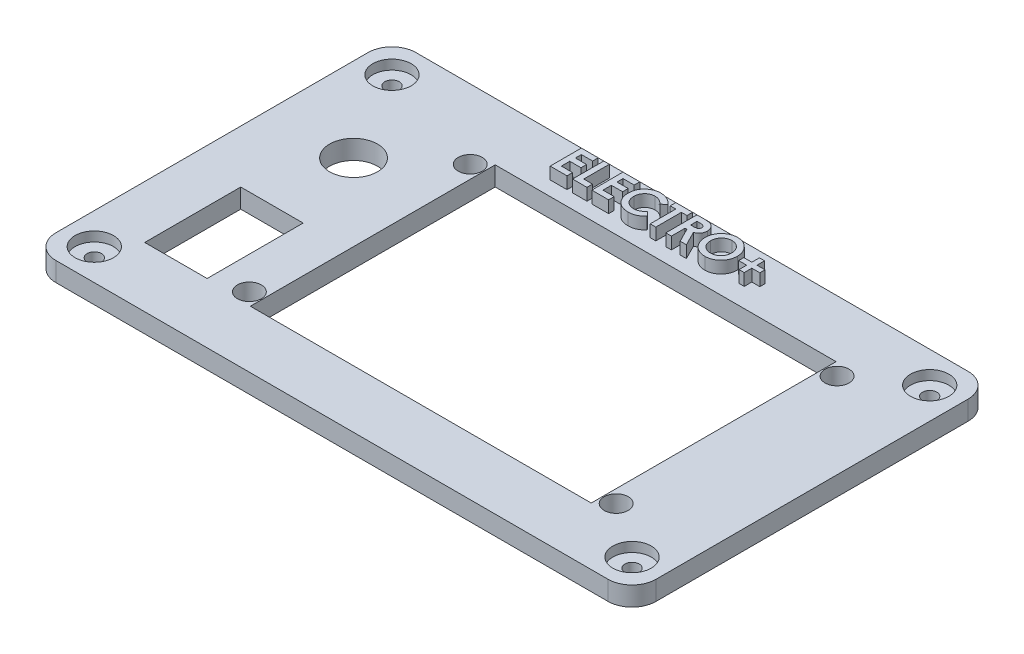
from build123d import *

# Parameters (mm, degrees)
CROQUIS1_W              = 114
CROQUIS1_H              = 64
SALIENTE_EXTRUIR1_DEPTH = 5
CROQUIS2_W              = 125
CROQUIS2_H              = 75
SALIENTE_EXTRUIR2_DEPTH = 4
CROQUIS4_R              = 2.5
CROQUIS4_W              = 71
CROQUIS4_H              = 51
CORTAR_EXTRUIR1_DEPTH   = 74.440452068
CROQUIS5_R              = 5
CROQUIS5_W              = 13
CROQUIS5_H              = 20
CORTAR_EXTRUIR2_DEPTH   = 74.440452068
CROQUIS12_W             = 84
CROQUIS12_H             = 4
CROQUIS12_W_2           = 4
CROQUIS12_H_2           = 34
CROQUIS12_W_3           = 106
CROQUIS12_H_3           = 56
CROQUIS12_R             = 5
CROQUIS12_R_2           = 2.5
CROQUIS12_W_4           = 71
CROQUIS12_H_4           = 51
CROQUIS12_W_5           = 13
CROQUIS12_H_5           = 20
CORTAR_EXTRUIR3_DEPTH   = 5
CROQUIS13_R             = 1.5
CORTAR_EXTRUIR4_DEPTH   = 10
REDONDEO1_R             = 5
CROQUIS15_R             = 4
CORTAR_EXTRUIR5_DEPTH   = 2
SALIENTE_EXTRUIR3_DEPTH = 2.5


with BuildPart() as part:
    # Croquis1 → Saliente-Extruir1 (new body)
    with BuildSketch(Plane(origin=(0, 0, 0), x_dir=(1, 0, 0), z_dir=(0, 1, 0))):
        Rectangle(CROQUIS1_W, CROQUIS1_H)
    extrude(amount=SALIENTE_EXTRUIR1_DEPTH)

    # Croquis2 → Saliente-Extruir2 (add)
    with BuildSketch(Plane(origin=(0, 5, 0), x_dir=(1, 0, 0), z_dir=(0, 1, 0))):
        Rectangle(CROQUIS2_W, CROQUIS2_H)
    extrude(amount=SALIENTE_EXTRUIR2_DEPTH)

    # Croquis4 → Cortar-Extruir1 (cut, through all)
    with BuildSketch(Plane.XZ):
        with Locations(Location((44.7, 23, 0), (0, 0, 270))):
            Circle(CROQUIS4_R)
        with Locations(Location((-31.7, 23, 0), (0, 0, 90))):
            Circle(CROQUIS4_R)
        with Locations(Location((44.7, -23, 0), (0, 0, 90))):
            Circle(CROQUIS4_R)
        with Locations(Location((-31.7, -23, 0), (0, 0, 270))):
            Circle(CROQUIS4_R)
        with Locations((6.5, 0)):
            Rectangle(CROQUIS4_W, CROQUIS4_H)
    extrude(amount=-CORTAR_EXTRUIR1_DEPTH, mode=Mode.SUBTRACT)

    # Croquis5 → Cortar-Extruir2 (cut, through all)
    with BuildSketch(Plane.XZ):
        with Locations(Location((-45, -12, 0), (0, 0, 270))):
            Circle(CROQUIS5_R)
        with Locations((-45, 15)):
            Rectangle(CROQUIS5_W, CROQUIS5_H)
    extrude(amount=-CORTAR_EXTRUIR2_DEPTH, mode=Mode.SUBTRACT)

    # Croquis12 → Cortar-Extruir3 (cut)
    # profile 1 of 9: a face of its own
    with BuildSketch(Plane.XZ):
        with Locations((0, 30)):
            Rectangle(CROQUIS12_W, CROQUIS12_H)
    # profile 2 of 9: a face of its own
    with BuildSketch(Plane.XZ):
        with Locations((-55, 0)):
            Rectangle(CROQUIS12_W_2, CROQUIS12_H_2)
    # profile 3 of 9: a face of its own
    with BuildSketch(Plane.XZ):
        with Locations((0, -30)):
            Rectangle(CROQUIS12_W, CROQUIS12_H)
    # profile 4 of 9: a face of its own
    with BuildSketch(Plane.XZ):
        with Locations((55, 0)):
            Rectangle(CROQUIS12_W_2, CROQUIS12_H_2)
    # profile 5 of 9: a face of its own
    with BuildSketch(Plane.XZ):
        Rectangle(CROQUIS12_W_3, CROQUIS12_H_3)
        with Locations(Location((-45, -12, 0), (0, 0, 270))):
            Circle(CROQUIS12_R, mode=Mode.SUBTRACT)
        with Locations(Location((-31.7, 23, 0), (0, 0, 270))):
            Circle(CROQUIS12_R_2, mode=Mode.SUBTRACT)
        with Locations(Location((-31.7, -23, 0), (0, 0, 270))):
            Circle(CROQUIS12_R_2, mode=Mode.SUBTRACT)
        with Locations(Location((44.7, -23, 0), (0, 0, 270))):
            Circle(CROQUIS12_R_2, mode=Mode.SUBTRACT)
        with Locations(Location((44.7, 23, 0), (0, 0, 270))):
            Circle(CROQUIS12_R_2, mode=Mode.SUBTRACT)
        with Locations((6.5, 0)):
            Rectangle(CROQUIS12_W_4, CROQUIS12_H_4, mode=Mode.SUBTRACT)
        with Locations((-45, 15)):
            Rectangle(CROQUIS12_W_5, CROQUIS12_H_5, mode=Mode.SUBTRACT)
    # profile 6 of 9: a face of its own
    with BuildSketch(Plane.XZ):
        Polygon((53, 28), (53, 17), (57, 17), (57, 32), (42, 32), (42, 28), align=None)
    # profile 7 of 9: a face of its own
    with BuildSketch(Plane.XZ):
        Polygon((53, -28), (42, -28), (42, -32), (57, -32), (57, -17), (53, -17), align=None)
    # profile 8 of 9: a face of its own
    with BuildSketch(Plane.XZ):
        Polygon((-42, -28), (-53, -28), (-53, -17), (-57, -17), (-57, -32), (-42, -32), align=None)
    # profile 9 of 9: a face of its own
    with BuildSketch(Plane.XZ):
        Polygon((-57, 17), (-53, 17), (-53, 28), (-42, 28), (-42, 32), (-57, 32), align=None)
    extrude(amount=-CORTAR_EXTRUIR3_DEPTH, mode=Mode.SUBTRACT)

    # Croquis13 → Cortar-Extruir4 (cut)
    with BuildSketch(Plane(origin=(0, 9, 0), x_dir=(1, 0, 0), z_dir=(0, 1, 0))):
        with Locations(Location((56, 31, 0), (0, 0, 270))):
            Circle(CROQUIS13_R)
        with Locations(Location((56, -31, 0), (0, 0, 90))):
            Circle(CROQUIS13_R)
        with Locations(Location((-56, -31, 0), (0, 0, 270))):
            Circle(CROQUIS13_R)
        with Locations(Location((-56, 31, 0), (0, 0, 90))):
            Circle(CROQUIS13_R)
    extrude(amount=-CORTAR_EXTRUIR4_DEPTH, mode=Mode.SUBTRACT)

    # Redondeo1
    redondeo1_edges = [part.edges().sort_by_distance(p)[0] for p in [
        (62.5, 7, 37.5),
        (62.5, 7, -37.5),
        (-62.5, 7, -37.5),
        (-62.5, 7, 37.5),
    ]]
    fillet(redondeo1_edges, radius=REDONDEO1_R)

    # Croquis15 → Cortar-Extruir5 (cut)
    with BuildSketch(Plane(origin=(0, 9, 0), x_dir=(1, 0, 0), z_dir=(0, 1, 0))):
        with Locations(Location((-56, 31, 0), (0, 0, 270))):
            Circle(CROQUIS15_R)
        with Locations(Location((56, 31, 0), (0, 0, 90))):
            Circle(CROQUIS15_R)
        with Locations(Location((56, -31, 0), (0, 0, 270))):
            Circle(CROQUIS15_R)
        with Locations(Location((-56, -31, 0), (0, 0, 90))):
            Circle(CROQUIS15_R)
    extrude(amount=-CORTAR_EXTRUIR5_DEPTH, mode=Mode.SUBTRACT)

    # Croquis16 → Saliente-Extruir3 (add)
    # profile 1 of 8: a face of its own
    with BuildSketch(Plane(origin=(0, 9, 0), x_dir=(1, 0, 0), z_dir=(0, 1, 0))):
        Polygon((-20.55, 35), (-17.05, 35), (-17.05, 33.833333333), (-19.383333333, 33.833333333), (-19.383333333, 32.583333333), (-17.05, 32.583333333), (-17.05, 31.416666667), (-19.383333333, 31.416666667), (-19.383333333, 29.666666667), (-17.05, 29.666666667), (-17.05, 28.5), (-20.55, 28.5), align=None)
    # profile 2 of 8: a face of its own
    with BuildSketch(Plane(origin=(0, 9, 0), x_dir=(1, 0, 0), z_dir=(0, 1, 0))):
        Polygon((-15.883333333, 35), (-14.716666667, 35), (-14.716666667, 29.666666667), (-12.883333333, 29.666666667), (-12.883333333, 28.5), (-15.883333333, 28.5), align=None)
    # profile 3 of 8: a face of its own
    with BuildSketch(Plane(origin=(0, 9, 0), x_dir=(1, 0, 0), z_dir=(0, 1, 0))):
        Polygon((-11.883333333, 35), (-8.383333333, 35), (-8.383333333, 33.833333333), (-10.716666667, 33.833333333), (-10.716666667, 32.583333333), (-8.383333333, 32.583333333), (-8.383333333, 31.416666667), (-10.716666667, 31.416666667), (-10.716666667, 29.666666667), (-8.383333333, 29.666666667), (-8.383333333, 28.5), (-11.883333333, 28.5), align=None)
    # profile 4 of 8: a face of its own
    with BuildSketch(Plane(origin=(0, 9, 0), x_dir=(1, 0, 0), z_dir=(0, 1, 0))):
        with BuildLine():
            Line((-1.383333333, 33.872395833), (-2.238802083, 33.0546875))
            add(Edge.make_bspline(
                [(-2.238802083, 33.0546875), (-2.311369912, 33.129722757), (-2.453117616, 33.27629012), (-2.681526511, 33.470332393), (-2.919063445, 33.632040373), (-3.161107612, 33.768229804), (-3.412012684, 33.871266815), (-3.668877516, 33.94635162), (-3.933342264, 33.992127988), (-4.112321834, 33.997365614), (-4.20234375, 34)],
                knots=[0, 0, 0, 0, 1.115251505, 2.178435587, 3.19620269, 4.182487026, 5.141301733, 6.088180966, 7.038406374, 8, 8, 8, 8], degree=3))
            add(Edge.make_bspline(
                [(-4.20234375, 34), (-4.27752299, 33.997918743), (-4.425880937, 33.993811613), (-4.643709281, 33.963702294), (-4.852073349, 33.912500087), (-5.051686405, 33.841933961), (-5.241961079, 33.750625139), (-5.423296305, 33.638644292), (-5.595245009, 33.507002767), (-5.755535848, 33.356381682), (-5.902164275, 33.191816828), (-6.031719826, 33.016226522), (-6.140243382, 32.83001303), (-6.2293069, 32.635062187), (-6.298683937, 32.430471663), (-6.348227858, 32.216379196), (-6.376882737, 31.99252982), (-6.38115967, 31.840358682), (-6.383333333, 31.763020833)],
                knots=[0, 0, 0, 0, 1.035432265, 2.043311493, 3.022114605, 3.98653278, 4.95457646, 5.923598177, 6.917315552, 7.932509744, 8.948865224, 9.949768934, 10.933144597, 11.912367597, 12.897413939, 13.903909035, 14.934704909, 16, 16, 16, 16], degree=3))
            add(Edge.make_bspline(
                [(-6.383333333, 31.763020833), (-6.382706908, 31.70873972), (-6.381472212, 31.60175053), (-6.367956277, 31.443483824), (-6.346192434, 31.289927704), (-6.314694761, 31.141314765), (-6.275306612, 30.997516219), (-6.229095344, 30.857291522), (-6.171123988, 30.722578265), (-6.106774908, 30.59181184), (-6.03193767, 30.468560373), (-5.951249322, 30.35102987), (-5.863755982, 30.239796454), (-5.76889095, 30.135314851), (-5.66531912, 30.039217873), (-5.555717441, 29.948615772), (-5.438237082, 29.865776624), (-5.31531841, 29.788621489), (-5.185899562, 29.721596167), (-5.053491972, 29.660884175), (-4.916088073, 29.61157701), (-4.775360841, 29.571830937), (-4.631813185, 29.538032838), (-4.484041076, 29.51722231), (-4.333325513, 29.50146274), (-4.23146709, 29.500489679), (-4.180208333, 29.5)],
                knots=[0, 0, 0, 0, 1.103660481, 2.175337485, 3.227646561, 4.255952547, 5.262355991, 6.258840057, 7.255597736, 8.242457506, 9.22035537, 10.185017736, 11.140346927, 12.096287581, 13.051739095, 14.01125915, 14.986044842, 15.97314143, 16.960198552, 17.947847494, 18.933482797, 19.925264591, 20.920966487, 21.929612487, 22.958107872, 24, 24, 24, 24], degree=3))
            add(Edge.make_bspline(
                [(-4.180208333, 29.5), (-4.093264673, 29.502514872), (-3.92244299, 29.507455942), (-3.671737608, 29.546094406), (-3.432840355, 29.609652494), (-3.241962594, 29.684710902), (-3.092414909, 29.758832054), (-2.978566468, 29.82739047), (-2.860838306, 29.904080586), (-2.741185788, 29.991796769), (-2.61826306, 30.089486391), (-2.494239992, 30.199289036), (-2.365941572, 30.31758906), (-2.281894548, 30.402022111), (-2.238802083, 30.4453125)],
                knots=[0, 0, 0, 0, 1.404581149, 2.759636711, 4.088442092, 5.392261763, 6.066678138, 6.783632037, 7.538459478, 8.336747902, 9.180226004, 10.074962426, 11.012997595, 12, 12, 12, 12], degree=3))
            Line((-2.238802083, 30.4453125), (-1.409375, 29.57421875))
            add(Edge.make_bspline(
                [(-1.409375, 29.57421875), (-1.46767926, 29.517927818), (-1.581476705, 29.408059957), (-1.753136993, 29.252057846), (-1.92458124, 29.111872607), (-2.091667709, 28.982416131), (-2.257133452, 28.867459799), (-2.420960921, 28.766888802), (-2.581295518, 28.678159555), (-2.741466642, 28.602768433), (-2.90247096, 28.538753541), (-3.068125482, 28.48364092), (-3.238936631, 28.437017626), (-3.415947642, 28.39939875), (-3.597507465, 28.369233491), (-3.785315259, 28.348872115), (-3.978180229, 28.335183839), (-4.109003526, 28.333953834), (-4.175, 28.333333333)],
                knots=[0, 0, 0, 0, 1.244526981, 2.429050516, 3.560637417, 4.644440555, 5.67424972, 6.652764056, 7.595344123, 8.486817594, 9.369275933, 10.254498637, 11.166417451, 12.086725134, 13.032340136, 13.991389299, 14.986715468, 16, 16, 16, 16], degree=3))
            add(Edge.make_bspline(
                [(-4.175, 28.333333333), (-4.296227347, 28.33642366), (-4.533435569, 28.342470571), (-4.881058033, 28.387274084), (-5.211290042, 28.462386386), (-5.524934989, 28.568615897), (-5.821893143, 28.70431912), (-6.102088532, 28.870684899), (-6.365069544, 29.067271226), (-6.608711809, 29.29177392), (-6.829097834, 29.539718298), (-7.023893557, 29.805942538), (-7.185028587, 30.091755037), (-7.318822475, 30.392933429), (-7.423447535, 30.710852108), (-7.497085841, 31.045854967), (-7.542498046, 31.397618539), (-7.547466206, 31.637881168), (-7.55, 31.760416667)],
                knots=[0, 0, 0, 0, 1.078019885, 2.10938526, 3.111377082, 4.085535484, 5.04941344, 6.010039228, 6.978205633, 7.964457913, 8.951525778, 9.924444315, 10.892603023, 11.863865945, 12.85144698, 13.863884204, 14.910567087, 16, 16, 16, 16], degree=3))
            add(Edge.make_bspline(
                [(-7.55, 31.760416667), (-7.548929342, 31.840333274), (-7.546807558, 31.998708457), (-7.524507419, 32.232007932), (-7.493419728, 32.45943319), (-7.444101933, 32.678622802), (-7.384654195, 32.892529657), (-7.310723123, 33.098828837), (-7.222426794, 33.298113267), (-7.122611207, 33.49071656), (-7.009690832, 33.67537696), (-6.883546377, 33.850507941), (-6.747425292, 34.017461483), (-6.59805681, 34.174022638), (-6.437611448, 34.321566042), (-6.265364817, 34.459292129), (-6.082352892, 34.589176048), (-5.888080329, 34.707868407), (-5.686321326, 34.815231955), (-5.479620594, 34.909931189), (-5.268485974, 34.989077941), (-5.053810162, 35.054727253), (-4.834686156, 35.103729822), (-4.612678006, 35.140823185), (-4.38589669, 35.161558613), (-4.233632683, 35.164953135), (-4.156770833, 35.166666667)],
                knots=[0, 0, 0, 0, 1.071919942, 2.124283339, 3.142214191, 4.149696895, 5.136002878, 6.119640489, 7.086990633, 8.058538607, 9.028339693, 9.988281803, 10.952401235, 11.916291999, 12.888973767, 13.874849856, 14.873389453, 15.898127285, 16.927174885, 17.938320013, 18.946391617, 19.950418109, 20.947802303, 21.956882652, 22.968648068, 24, 24, 24, 24], degree=3))
            add(Edge.make_bspline(
                [(-4.156770833, 35.166666667), (-4.091199795, 35.165684427), (-3.960739474, 35.163730162), (-3.766462165, 35.147439229), (-3.573738594, 35.121854485), (-3.383258772, 35.083252554), (-3.193660192, 35.037427184), (-3.007434392, 34.977425183), (-2.821643559, 34.910541645), (-2.639201547, 34.830596033), (-2.459853692, 34.743328176), (-2.287801502, 34.644319623), (-2.120156236, 34.539663249), (-1.960632812, 34.423165033), (-1.806243013, 34.29905058), (-1.657794156, 34.166740828), (-1.516588968, 34.024029785), (-1.427976432, 33.923196008), (-1.383333333, 33.872395833)],
                knots=[0, 0, 0, 0, 0.996412454, 1.982464992, 2.961075852, 3.949442424, 4.934965278, 5.923860011, 6.921385422, 7.934793307, 8.949617135, 9.951082467, 10.950285876, 11.951772932, 12.951063433, 13.960125323, 14.972308753, 16, 16, 16, 16], degree=3))
        make_face()
    # profile 5 of 8: a face of its own
    with BuildSketch(Plane(origin=(0, 9, 0), x_dir=(1, 0, 0), z_dir=(0, 1, 0))):
        Polygon((-0.883333333, 35), (2.616666667, 35), (2.616666667, 33.833333333), (1.45, 33.833333333), (1.45, 28.5), (0.283333333, 28.5), (0.283333333, 33.833333333), (-0.883333333, 33.833333333), align=None)
    # profile 6 of 8: a face of its own
    with BuildSketch(Plane(origin=(0, 9, 0), x_dir=(1, 0, 0), z_dir=(0, 1, 0))):
        with BuildLine():
            Line((3.533333333, 35), (4.892708333, 35))
            add(Edge.make_bspline(
                [(4.892708333, 35), (4.982562607, 34.999681069), (5.155377686, 34.999067675), (5.404567591, 34.989389937), (5.633482788, 34.97592257), (5.842462206, 34.955371011), (6.031416441, 34.928122127), (6.20053487, 34.896000203), (6.349812548, 34.859390384), (6.480508427, 34.81377166), (6.598454995, 34.762314432), (6.708397594, 34.703189133), (6.812761722, 34.637054142), (6.910849816, 34.562169269), (7.003514286, 34.479881674), (7.090929948, 34.390108527), (7.171861539, 34.292088588), (7.245807926, 34.186441219), (7.313204105, 34.075302609), (7.372768193, 33.958520165), (7.421205807, 33.836012671), (7.464005632, 33.709550627), (7.49483296, 33.577326232), (7.516272915, 33.440626714), (7.531970412, 33.298970874), (7.532872943, 33.202736187), (7.533333333, 33.153645833)],
                knots=[0, 0, 0, 0, 1.749336639, 3.364467119, 4.854658419, 6.213483162, 7.451590619, 8.570285859, 9.5643256, 10.440900261, 11.26203566, 12.067320669, 12.869050712, 13.665104639, 14.467235401, 15.27997916, 16.102287765, 16.939272006, 17.78853747, 18.631303466, 19.488103222, 20.351255419, 21.228522269, 22.127379805, 23.044756219, 24, 24, 24, 24], degree=3))
            add(Edge.make_bspline(
                [(7.533333333, 33.153645833), (7.532137404, 33.102406782), (7.529792403, 33.00193634), (7.517160956, 32.854353456), (7.494074638, 32.713156475), (7.459107052, 32.578758805), (7.418916352, 32.449487711), (7.365473032, 32.327728324), (7.305156963, 32.211709831), (7.23352133, 32.103073358), (7.154904722, 31.999405871), (7.063475261, 31.904679257), (6.965156172, 31.813802318), (6.854420579, 31.732467278), (6.736149812, 31.655174554), (6.607993954, 31.585126763), (6.470789395, 31.520563064), (6.374327795, 31.484557886), (6.325, 31.466145833)],
                knots=[0, 0, 0, 0, 1.099860209, 2.156625411, 3.176576793, 4.16617041, 5.135385252, 6.078461593, 7.016046972, 7.938469504, 8.868247731, 9.803980173, 10.76021508, 11.73834243, 12.748633912, 13.790971185, 14.870363756, 16, 16, 16, 16], degree=3))
            Line((6.325, 31.466145833), (7.825, 28.5))
            Line((7.825, 28.5), (6.528125, 28.5))
            Line((6.528125, 28.5), (5.095833333, 31.333333333))
            Line((5.095833333, 31.333333333), (4.7, 31.333333333))
            Line((4.7, 31.333333333), (4.7, 28.5))
            Line((4.7, 28.5), (3.533333333, 28.5))
            Line((3.533333333, 28.5), (3.533333333, 35))
        make_face()
        with BuildLine():
            Line((4.7, 32.5), (5.154427083, 32.5))
            add(Edge.make_bspline(
                [(5.154427083, 32.5), (5.209984572, 32.500625726), (5.316365224, 32.501823856), (5.469354574, 32.507381282), (5.608305391, 32.520771931), (5.733814374, 32.537690516), (5.846513075, 32.557225465), (5.945396261, 32.585220234), (6.03198757, 32.615217337), (6.105260892, 32.652495955), (6.167863935, 32.694889829), (6.221917656, 32.743050324), (6.266627833, 32.798789965), (6.30342659, 32.860593988), (6.332052022, 32.929009035), (6.352946394, 33.003284063), (6.364623258, 33.084265162), (6.365966721, 33.140153146), (6.366666667, 33.169270833)],
                knots=[0, 0, 0, 0, 1.688639943, 3.233382647, 4.650958383, 5.928841754, 7.082724185, 8.122798841, 9.049171256, 9.863274652, 10.613301712, 11.341792392, 12.054588806, 12.776240173, 13.521029143, 14.301969904, 15.115324896, 16, 16, 16, 16], degree=3))
            add(Edge.make_bspline(
                [(6.366666667, 33.169270833), (6.365343356, 33.203719183), (6.362743957, 33.271386581), (6.336949845, 33.368803908), (6.295891189, 33.458970309), (6.239611019, 33.54147839), (6.168733461, 33.613810669), (6.087395871, 33.67757215), (5.993842787, 33.727989958), (5.907219672, 33.761245007), (5.828412885, 33.781141846), (5.757292245, 33.795968795), (5.674934117, 33.806477079), (5.581276323, 33.817622984), (5.476557602, 33.82485054), (5.360207172, 33.830125215), (5.232559192, 33.832283344), (5.143576427, 33.832973259), (5.097135417, 33.833333333)],
                knots=[0, 0, 0, 0, 1.020303359, 2.004196876, 2.966617323, 3.9489082, 4.950758222, 5.960522915, 7.003732012, 8.091992268, 8.70421221, 9.413913587, 10.24622431, 11.166358409, 12.212345909, 13.359657661, 14.621978493, 16, 16, 16, 16], degree=3))
            Line((5.097135417, 33.833333333), (4.7, 33.833333333))
            Line((4.7, 33.833333333), (4.7, 32.5))
        make_face(mode=Mode.SUBTRACT)
    # profile 7 of 8: a face of its own
    with BuildSketch(Plane(origin=(0, 9, 0), x_dir=(1, 0, 0), z_dir=(0, 1, 0))):
        with BuildLine():
            add(Edge.make_bspline(
                [(11.838020833, 35.166666667), (11.951031299, 35.163740623), (12.174139556, 35.157963951), (12.50225129, 35.109810879), (12.818447613, 35.031352351), (13.122585543, 34.922289323), (13.413903553, 34.779667813), (13.693429218, 34.607531235), (13.960161292, 34.402630614), (14.211366518, 34.169745943), (14.443525452, 33.916494032), (14.644691304, 33.643823325), (14.816238163, 33.358798995), (14.958416659, 33.06065731), (15.066712047, 32.747333496), (15.1427074, 32.420425091), (15.19153065, 32.080025098), (15.197146075, 31.8482591), (15.2, 31.73046875)],
                knots=[0, 0, 0, 0, 1.014329547, 2.002516266, 2.970391464, 3.935626869, 4.897733899, 5.877609409, 6.878433252, 7.912639331, 8.949961323, 9.958554974, 10.949718813, 11.932905612, 12.9188844, 13.919928257, 14.942845884, 16, 16, 16, 16], degree=3))
            add(Edge.make_bspline(
                [(15.2, 31.73046875), (15.196960693, 31.614005625), (15.190971641, 31.384511301), (15.144700579, 31.047248227), (15.067425455, 30.723841693), (14.960966841, 30.413559659), (14.821366926, 30.117905026), (14.653165418, 29.834990079), (14.451923798, 29.567440337), (14.22498214, 29.315399378), (13.975139069, 29.086618125), (13.710515594, 28.885005041), (13.432333584, 28.714165723), (13.141000208, 28.574178421), (12.835890716, 28.465539432), (12.517758766, 28.388886731), (12.186624042, 28.342303337), (11.961436372, 28.336353405), (11.847135417, 28.333333333)],
                knots=[0, 0, 0, 0, 1.051557043, 2.072126891, 3.067553643, 4.050577992, 5.02905126, 6.015227836, 7.017913613, 8.04756643, 9.074058332, 10.072836633, 11.047628519, 12.017157415, 12.98668631, 13.966869689, 14.968021931, 16, 16, 16, 16], degree=3))
            add(Edge.make_bspline(
                [(11.847135417, 28.333333333), (11.727590323, 28.336042487), (11.492700553, 28.341365602), (11.148938324, 28.391986004), (10.819584405, 28.468238012), (10.507405558, 28.582040043), (10.20922251, 28.724302151), (9.927226098, 28.899506466), (9.661511091, 29.10736345), (9.413601675, 29.342549808), (9.188995144, 29.599895268), (8.990735823, 29.871757925), (8.823499688, 30.156060987), (8.68728062, 30.452937515), (8.579890978, 30.760542494), (8.504139788, 31.080749326), (8.459391752, 31.412790038), (8.453158611, 31.638318728), (8.45, 31.752604167)],
                knots=[0, 0, 0, 0, 1.067978421, 2.098431617, 3.099715153, 4.085208694, 5.062210972, 6.048429807, 7.046490867, 8.072918869, 9.098532598, 10.095778865, 11.076610158, 12.041847152, 13.011192615, 13.984257998, 14.978533688, 16, 16, 16, 16], degree=3))
            add(Edge.make_bspline(
                [(8.45, 31.752604167), (8.450991354, 31.829489427), (8.452961509, 31.982286404), (8.476694103, 32.208723724), (8.510862215, 32.430741291), (8.561395232, 32.647453919), (8.622779931, 32.860390414), (8.70231248, 33.06756871), (8.792842044, 33.271202041), (8.898617316, 33.468885244), (9.016229192, 33.658799466), (9.144554219, 33.840048851), (9.283915069, 34.010441826), (9.433862816, 34.171098146), (9.594914198, 34.320961804), (9.764950753, 34.462154329), (9.947270198, 34.590925146), (10.137882133, 34.710419095), (10.335711933, 34.8184754), (10.539954249, 34.910449695), (10.746401287, 34.990769281), (10.957810901, 35.054161049), (11.171917461, 35.105792982), (11.391008262, 35.139938064), (11.613103943, 35.163670001), (11.762870612, 35.165665408), (11.838020833, 35.166666667)],
                knots=[0, 0, 0, 0, 1.034744296, 2.056386356, 3.06226378, 4.057406941, 5.050368692, 6.043467995, 7.042652155, 8.049140477, 9.059438543, 10.048523776, 11.036952808, 12.020949711, 13.004946614, 13.997082645, 14.994316842, 16.007702937, 17.024872941, 18.026463647, 19.021641123, 20.005082605, 20.995858141, 21.984425357, 22.988620895, 24, 24, 24, 24], degree=3))
        make_face()
        with BuildLine():
            add(Edge.make_bspline(
                [(11.819791667, 34), (11.743735638, 33.997959246), (11.593631472, 33.993931614), (11.373455997, 33.963246507), (11.162079765, 33.914238904), (10.960674519, 33.843251989), (10.768367351, 33.752903664), (10.584817359, 33.643509615), (10.412566332, 33.511309545), (10.249317468, 33.363400686), (10.101848983, 33.198596225), (9.971555924, 33.021980218), (9.86252162, 32.83384761), (9.771204707, 32.635946108), (9.70246331, 32.426050362), (9.653500874, 32.205804509), (9.622558443, 31.974829054), (9.618658111, 31.817373387), (9.616666667, 31.736979167)],
                knots=[0, 0, 0, 0, 1.033739768, 2.040188636, 3.016340934, 3.979330865, 4.937572243, 5.900995986, 6.878200029, 7.884839167, 8.891893314, 9.879764717, 10.863503415, 11.843163062, 12.837761627, 13.859916423, 14.907309254, 16, 16, 16, 16], degree=3))
            add(Edge.make_bspline(
                [(9.616666667, 31.736979167), (9.619307017, 31.647884286), (9.624481667, 31.473273083), (9.660891134, 31.218554964), (9.723184107, 30.977998982), (9.813133949, 30.752781659), (9.924695351, 30.540402126), (10.063236907, 30.343463396), (10.226514899, 30.160786292), (10.352302941, 30.05413179), (10.416145833, 30)],
                knots=[0, 0, 0, 0, 1.078454662, 2.113592447, 3.107694534, 4.079536787, 5.043276885, 6.005368276, 6.987637804, 8, 8, 8, 8], degree=3))
            add(Edge.make_bspline(
                [(10.416145833, 30), (10.468445351, 29.960009512), (10.571866068, 29.88092953), (10.73694805, 29.779572309), (10.906949985, 29.69269906), (11.083154751, 29.622506503), (11.265190212, 29.567294217), (11.453031407, 29.528629961), (11.646412179, 29.504364797), (11.77718532, 29.50146465), (11.843229167, 29.5)],
                knots=[0, 0, 0, 0, 1.023928204, 2.024787132, 3.009472467, 3.9914905, 4.972207045, 5.96565515, 6.972602802, 8, 8, 8, 8], degree=3))
            add(Edge.make_bspline(
                [(11.843229167, 29.5), (11.91797741, 29.502058057), (12.06504693, 29.50610735), (12.28112372, 29.536414706), (12.488131847, 29.587705696), (12.687356436, 29.658069888), (12.878223012, 29.749552615), (13.059798757, 29.862339724), (13.232402025, 29.995046335), (13.395442911, 30.144897561), (13.544469989, 30.310351237), (13.674491153, 30.487909296), (13.786992204, 30.673659602), (13.87641018, 30.870231169), (13.947867394, 31.075768454), (13.996240541, 31.291181737), (14.027444366, 31.515583003), (14.031345797, 31.668295994), (14.033333333, 31.74609375)],
                knots=[0, 0, 0, 0, 1.026359118, 2.019393844, 2.989460624, 3.950973911, 4.916101784, 5.890408035, 6.881132271, 7.902007068, 8.92769091, 9.933912415, 10.920395702, 11.90457117, 12.894218921, 13.903490204, 14.931958862, 16, 16, 16, 16], degree=3))
            add(Edge.make_bspline(
                [(14.033333333, 31.74609375), (14.031277028, 31.823444147), (14.027229506, 31.975696608), (13.996868806, 32.199520939), (13.945903091, 32.413983236), (13.875327603, 32.619433737), (13.785206441, 32.81607386), (13.673762482, 33.003212103), (13.541386769, 33.180667548), (13.391125921, 33.347230904), (13.227576222, 33.50029196), (13.051989279, 33.633121132), (12.869278211, 33.74854546), (12.675250735, 33.838964217), (12.473876491, 33.91100065), (12.263926682, 33.964049312), (12.04460611, 33.99371605), (11.895397791, 33.997886679), (11.819791667, 34)],
                knots=[0, 0, 0, 0, 1.055025985, 2.07665775, 3.074803781, 4.057872707, 5.035505728, 6.020516407, 7.023567878, 8.050795229, 9.077271434, 10.074415901, 11.050397877, 12.019801805, 12.988065821, 13.964604439, 14.968634123, 16, 16, 16, 16], degree=3))
        make_face(mode=Mode.SUBTRACT)
    # profile 8 of 8: a face of its own
    with BuildSketch(Plane(origin=(0, 9, 0), x_dir=(1, 0, 0), z_dir=(0, 1, 0))):
        Polygon((17.783333333, 32.166666667), (17.783333333, 33.75), (18.866666667, 33.75), (18.866666667, 32.166666667), (20.533333333, 32.166666667), (20.533333333, 31.083333333), (18.866666667, 31.083333333), (18.866666667, 29.5), (17.783333333, 29.5), (17.783333333, 31.083333333), (16.116666667, 31.083333333), (16.116666667, 32.166666667), align=None)
    extrude(amount=SALIENTE_EXTRUIR3_DEPTH)


solid = part.part
